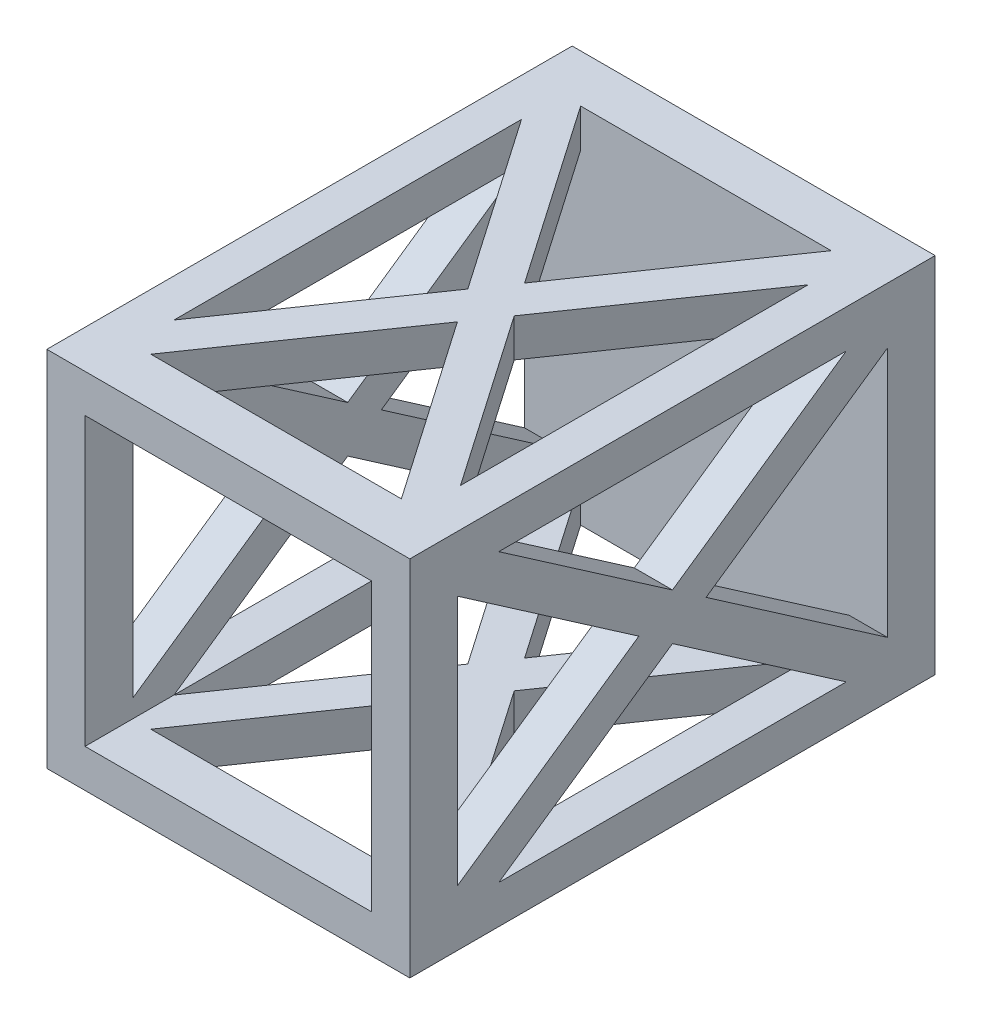
from build123d import *

# Parameters (mm, degrees)
SKETCH1_W           = 76
SKETCH1_H           = 76
BOSS_EXTRUDE1_DEPTH = 110
SKETCH2_W           = 60
SKETCH2_H           = 60
CUT_EXTRUDE1_DEPTH  = 100
CUT_EXTRUDE2_REACH  = 140.996
CUT_EXTRUDE3_REACH  = 140.996


with BuildPart() as part:
    # Sketch1 → Boss-Extrude1 (new body)
    with BuildSketch(Plane.XY):
        Rectangle(SKETCH1_W, SKETCH1_H)
    extrude(amount=BOSS_EXTRUDE1_DEPTH)

    # Sketch2 → Cut-Extrude1 (cut)
    with BuildSketch(Plane.XY.offset(110)):
        Rectangle(SKETCH2_W, SKETCH2_H)
    extrude(amount=-CUT_EXTRUDE1_DEPTH, mode=Mode.SUBTRACT)

    # Cut-Extrude2: up to this face of the body (flat: up to its plane)
    cut_extrude2_end = Plane(part.part.faces().sort_by_distance((0, -38, 55))[0])
    # Sketch4 → Cut-Extrude2 (cut, up to the picked face)
    with BuildSketch(Plane(origin=(0, 38, 0), x_dir=(1, 0, 0), z_dir=(0, 1, 0)), mode=Mode.PRIVATE) as cut_extrude2_sk1:
        Polygon((-26.229048752, -10), (0, -47.963096879), (26.229048752, -10), align=None)
    cut_extrude2_tool1 = split(extrude(cut_extrude2_sk1.sketch, amount=-CUT_EXTRUDE2_REACH, mode=Mode.PRIVATE), bisect_by=cut_extrude2_end, keep=Keep.BOTH, mode=Mode.PRIVATE)
    # Sketch4 → Cut-Extrude2 (cut, up to the picked face)
    with BuildSketch(Plane(origin=(0, 38, 0), x_dir=(1, 0, 0), z_dir=(0, 1, 0)), mode=Mode.PRIVATE) as cut_extrude2_sk2:
        Polygon((0, -62.036903121), (26.229048752, -100), (-26.229048752, -100), align=None)
    cut_extrude2_tool2 = split(extrude(cut_extrude2_sk2.sketch, amount=-CUT_EXTRUDE2_REACH, mode=Mode.PRIVATE), bisect_by=cut_extrude2_end, keep=Keep.BOTH, mode=Mode.PRIVATE)
    # Sketch4 → Cut-Extrude2 (cut, up to the picked face)
    with BuildSketch(Plane(origin=(0, 38, 0), x_dir=(1, 0, 0), z_dir=(0, 1, 0)), mode=Mode.PRIVATE) as cut_extrude2_sk3:
        Polygon((4.861860338, -55), (30, -18.61585049), (30, -91.38414951), align=None)
    cut_extrude2_tool3 = split(extrude(cut_extrude2_sk3.sketch, amount=-CUT_EXTRUDE2_REACH, mode=Mode.PRIVATE), bisect_by=cut_extrude2_end, keep=Keep.BOTH, mode=Mode.PRIVATE)
    # Sketch4 → Cut-Extrude2 (cut, up to the picked face)
    with BuildSketch(Plane(origin=(0, 38, 0), x_dir=(1, 0, 0), z_dir=(0, 1, 0)), mode=Mode.PRIVATE) as cut_extrude2_sk4:
        Polygon((-30, -91.38414951), (-4.861860338, -55), (-30, -18.61585049), align=None)
    cut_extrude2_tool4 = split(extrude(cut_extrude2_sk4.sketch, amount=-CUT_EXTRUDE2_REACH, mode=Mode.PRIVATE), bisect_by=cut_extrude2_end, keep=Keep.BOTH, mode=Mode.PRIVATE)
    add(cut_extrude2_tool1.solids().sort_by(Axis((0, 38, 22.654366), (0, -1, 0)))[0], mode=Mode.SUBTRACT)
    add(cut_extrude2_tool2.solids().sort_by(Axis((0, 38, 87.345634), (0, -1, 0)))[0], mode=Mode.SUBTRACT)
    add(cut_extrude2_tool3.solids().sort_by(Axis((21.62062, 38, 55), (0, -1, 0)))[0], mode=Mode.SUBTRACT)
    add(cut_extrude2_tool4.solids().sort_by(Axis((-21.62062, 38, 55), (0, -1, 0)))[0], mode=Mode.SUBTRACT)

    # Cut-Extrude3: up to this face of the body (flat: up to its plane)
    cut_extrude3_end = Plane(part.part.faces().sort_by_distance((38, 0, 55))[0])
    # Sketch5 → Cut-Extrude3 (cut, up to the picked face)
    with BuildSketch(Plane.ZY.offset(38), mode=Mode.PRIVATE) as cut_extrude3_sk1:
        Polygon((18.61585049, 30), (55, 4.861860338), (91.38414951, 30), align=None)
    cut_extrude3_tool1 = split(extrude(cut_extrude3_sk1.sketch, amount=-CUT_EXTRUDE3_REACH, mode=Mode.PRIVATE), bisect_by=cut_extrude3_end, keep=Keep.BOTH, mode=Mode.PRIVATE)
    # Sketch5 → Cut-Extrude3 (cut, up to the picked face)
    with BuildSketch(Plane.ZY.offset(38), mode=Mode.PRIVATE) as cut_extrude3_sk2:
        Polygon((91.38414951, -30), (18.61585049, -30), (55, -4.861860338), align=None)
    cut_extrude3_tool2 = split(extrude(cut_extrude3_sk2.sketch, amount=-CUT_EXTRUDE3_REACH, mode=Mode.PRIVATE), bisect_by=cut_extrude3_end, keep=Keep.BOTH, mode=Mode.PRIVATE)
    # Sketch5 → Cut-Extrude3 (cut, up to the picked face)
    with BuildSketch(Plane.ZY.offset(38), mode=Mode.PRIVATE) as cut_extrude3_sk3:
        Polygon((10, 26.229048752), (47.963096879, 0), (10, -26.229048752), align=None)
    cut_extrude3_tool3 = split(extrude(cut_extrude3_sk3.sketch, amount=-CUT_EXTRUDE3_REACH, mode=Mode.PRIVATE), bisect_by=cut_extrude3_end, keep=Keep.BOTH, mode=Mode.PRIVATE)
    # Sketch5 → Cut-Extrude3 (cut, up to the picked face)
    with BuildSketch(Plane.ZY.offset(38), mode=Mode.PRIVATE) as cut_extrude3_sk4:
        Polygon((62.036903121, 0), (100, -26.229048752), (100, 26.229048752), align=None)
    cut_extrude3_tool4 = split(extrude(cut_extrude3_sk4.sketch, amount=-CUT_EXTRUDE3_REACH, mode=Mode.PRIVATE), bisect_by=cut_extrude3_end, keep=Keep.BOTH, mode=Mode.PRIVATE)
    add(cut_extrude3_tool1.solids().sort_by(Axis((-38, 21.62062, 55), (1, 0, 0)))[0], mode=Mode.SUBTRACT)
    add(cut_extrude3_tool2.solids().sort_by(Axis((-38, -21.62062, 55), (1, 0, 0)))[0], mode=Mode.SUBTRACT)
    add(cut_extrude3_tool3.solids().sort_by(Axis((-38, 0, 22.654366), (1, 0, 0)))[0], mode=Mode.SUBTRACT)
    add(cut_extrude3_tool4.solids().sort_by(Axis((-38, 0, 87.345634), (1, 0, 0)))[0], mode=Mode.SUBTRACT)


solid = part.part
